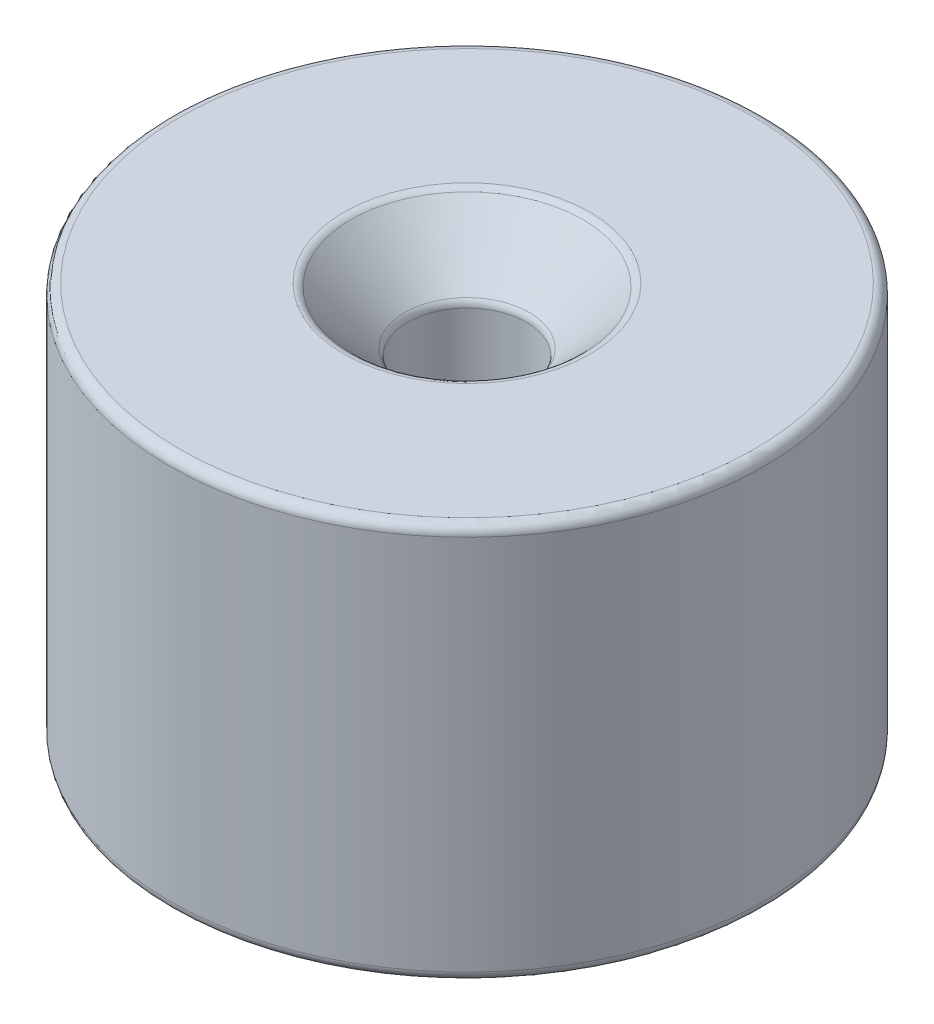
from build123d import *

# Parameters (mm, degrees)
SKETCH1_R           = 15
SKETCH1_R_2         = 3
BOSS_EXTRUDE1_DEPTH = 20
CHAMFER1_SIZE       = 3
FILLET1_R           = 0.5


with BuildPart() as part:
    # Sketch1 → Boss-Extrude1 (new body)
    with BuildSketch(Plane(origin=(0, 0, 0), x_dir=(1, 0, 0), z_dir=(0, 1, 0))):
        with Locations(Location((0, 0, 0), (0, 0, 270))):
            Circle(SKETCH1_R)
        with Locations(Location((0, 0, 0), (0, 0, 270))):
            Circle(SKETCH1_R_2, mode=Mode.SUBTRACT)
    extrude(amount=BOSS_EXTRUDE1_DEPTH)

    # Chamfer1
    chamfer1_edges = [part.edges().sort_by_distance(p)[0] for p in [
        (0, 20, -3),
    ]]
    chamfer(chamfer1_edges, length=CHAMFER1_SIZE)

    # Fillet1
    fillet1_edges = [part.edges().sort_by_distance(p)[0] for p in [
        (0, 0, -15),
        (0, 20, -15),
        (0, 0, -3),
        (0, 17, -3),
        (0, 20, -6),
    ]]
    fillet(fillet1_edges, radius=FILLET1_R)


solid = part.part
